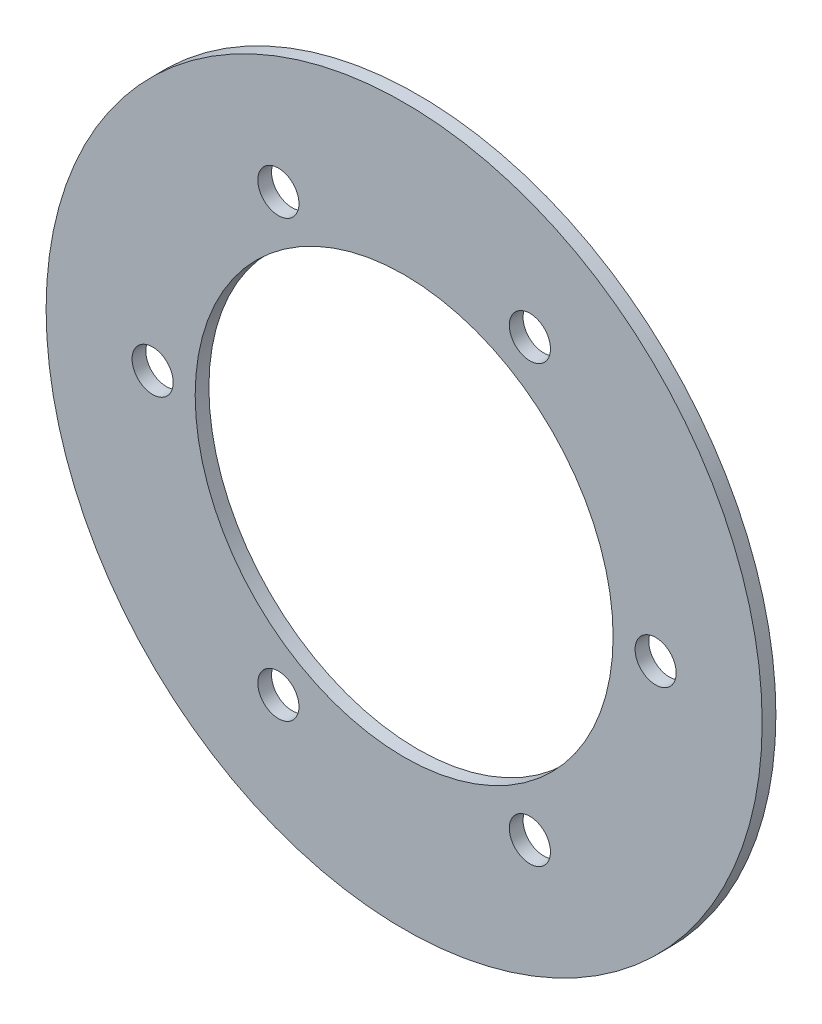
from build123d import *

# Parameters (mm, degrees)
SKIZZE1_R                       = 39.15
SKIZZE1_R_2                     = 22.85
AUFSATZ_LINEAR_AUSTRAGEN1_DEPTH = 1.5
DURCHGANGSLOCH_F_R_M41_D        = 4.5


with BuildPart() as part:
    # Skizze1 → Aufsatz-Linear austragen1 (new body)
    with BuildSketch(Plane.XY):
        Circle(SKIZZE1_R)
        Circle(SKIZZE1_R_2, mode=Mode.SUBTRACT)
    extrude(amount=AUFSATZ_LINEAR_AUSTRAGEN1_DEPTH)

    # Durchgangsloch für M41 (through all)
    with Locations(Plane.XY.offset(1.5)):
        with Locations((27.5, 0), (13.75, -23.815698604), (-13.75, -23.815698604), (-27.5, 0), (-13.75, 23.815698604), (13.75, 23.815698604)):
            Hole(DURCHGANGSLOCH_F_R_M41_D / 2)


solid = part.part
